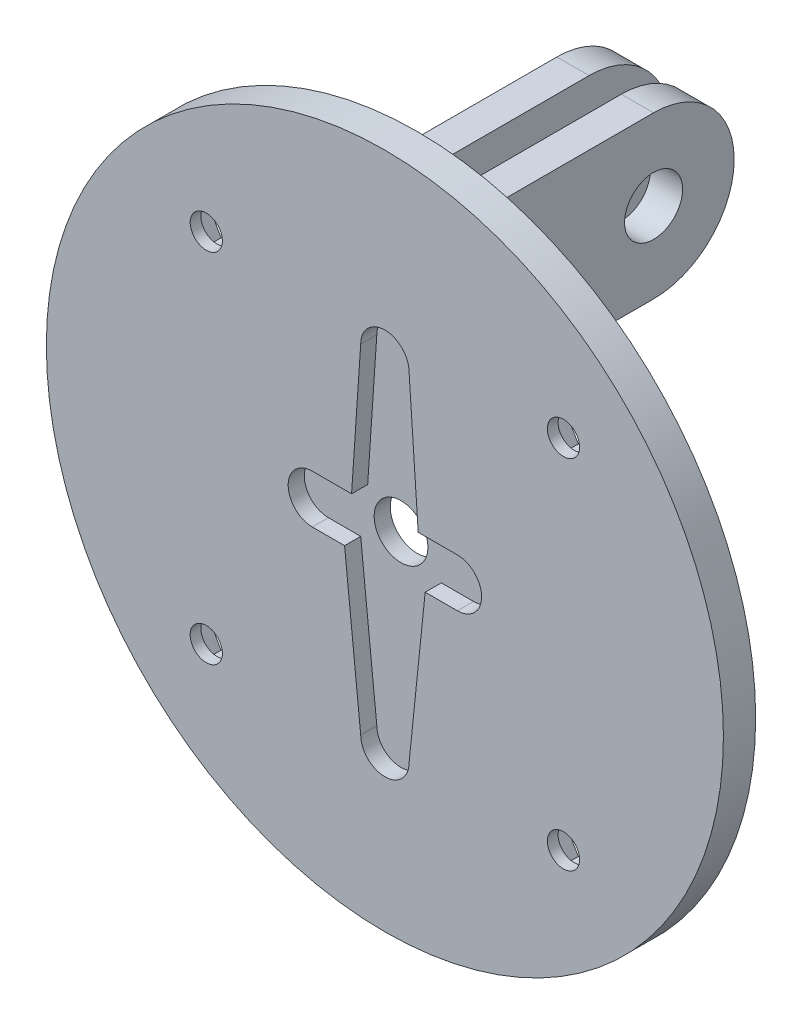
from build123d import *

# Parameters (mm, degrees)
CROQUIS1_R              = 31.5
CROQUIS1_R_2            = 1.5
SALIENTE_EXTRUIR1_DEPTH = 3
CORTAR_EXTRUIR2_DEPTH   = 1.5
CROQUIS4_R              = 2.5
CORTAR_EXTRUIR3_DEPTH   = 3
CROQUIS5_W              = 3
CROQUIS5_H              = 15
SALIENTE_EXTRUIR2_DEPTH = 25
CORTAR_EXTRUIR4_START   = -9
CROQUIS6_R              = 2.7
CORTAR_EXTRUIR4_DEPTH   = 9
CORTAR_EXTRUIR5_DEPTH   = 2


with BuildPart() as part:
    # Croquis1 → Saliente-Extruir1 (new body)
    with BuildSketch(Plane.XY):
        with Locations((-43.449193048, 8.207110309)):
            Circle(CROQUIS1_R)
        with Locations((-60.066202406, 24.824119667)):
            Circle(CROQUIS1_R_2, mode=Mode.SUBTRACT)
        with Locations((-26.83218369, 24.824119667)):
            Circle(CROQUIS1_R_2, mode=Mode.SUBTRACT)
        with Locations((-26.83218369, -8.409899049)):
            Circle(CROQUIS1_R_2, mode=Mode.SUBTRACT)
        with Locations((-60.066202406, -8.409899049)):
            Circle(CROQUIS1_R_2, mode=Mode.SUBTRACT)
    extrude(amount=SALIENTE_EXTRUIR1_DEPTH)

    # Croquis3 → Cortar-Extruir2 (cut)
    with BuildSketch(Plane.XY.offset(3)):
        with BuildLine():
            Line((-41.199193048, 22.957110309), (-40.349193048, 10.457110309))
            Line((-40.349193048, 10.457110309), (-36.699193048, 10.457110309))
            ThreePointArc((-36.699193048, 10.457110309), (-34.449193048, 8.207110309), (-36.699193048, 5.957110309))
            Line((-36.699193048, 5.957110309), (-39.699193048, 5.957110309))
            Line((-39.699193048, 5.957110309), (-41.199193048, -8.542889691))
            ThreePointArc((-41.199193048, -8.542889691), (-43.449193048, -10.792889691), (-45.699193048, -8.542889691))
            Line((-45.699193048, -8.542889691), (-47.199193048, 5.957110309))
            Line((-47.199193048, 5.957110309), (-50.199193048, 5.957110309))
            ThreePointArc((-50.199193048, 5.957110309), (-52.449193048, 8.207110309), (-50.199193048, 10.457110309))
            Line((-50.199193048, 10.457110309), (-46.549193048, 10.457110309))
            Line((-46.549193048, 10.457110309), (-45.699193048, 22.957110309))
            ThreePointArc((-45.699193048, 22.957110309), (-43.449193048, 25.207110309), (-41.199193048, 22.957110309))
        make_face()
    extrude(amount=-CORTAR_EXTRUIR2_DEPTH, mode=Mode.SUBTRACT)

    # Croquis4 → Cortar-Extruir3 (cut)
    with BuildSketch(Plane(origin=(0, 0, 0), x_dir=(-1, 0, 0), z_dir=(0, 0, -1))):
        with Locations((43.449193048, 8.207110309)):
            Circle(CROQUIS4_R)
    extrude(amount=-CORTAR_EXTRUIR3_DEPTH, mode=Mode.SUBTRACT)

    # Croquis5 → Saliente-Extruir2 (add)
    with BuildSketch(Plane(origin=(0, 0, 0), x_dir=(-1, 0, 0), z_dir=(0, 0, -1))):
        with Locations((40.449193048, 27.207110309)):
            Rectangle(CROQUIS5_W, CROQUIS5_H)
        with Locations((46.449193048, 27.207110309)):
            Rectangle(CROQUIS5_W, CROQUIS5_H)
    extrude(amount=SALIENTE_EXTRUIR2_DEPTH)

    # Croquis6 → Cortar-Extruir4 (cut)
    with BuildSketch(Plane(origin=(-38.949193048, 0, 0), x_dir=(0, 0, -1), z_dir=(1, 0, 0)).offset(CORTAR_EXTRUIR4_START)):
        with BuildLine():
            Line((25, 34.707110309), (17.5, 34.707110309))
            ThreePointArc((17.5, 34.707110309), (22.803300859, 32.510411168), (25, 27.207110309))
            Line((25, 27.207110309), (25, 34.707110309))
        make_face()
        with BuildLine():
            Line((25, 19.707110309), (25, 27.207110309))
            ThreePointArc((25, 27.207110309), (22.803300859, 21.90380945), (17.5, 19.707110309))
            Line((17.5, 19.707110309), (25, 19.707110309))
        make_face()
        with Locations(Location((17.5, 27.207110309, 0), (0, 0, 90))):
            Circle(CROQUIS6_R)
    extrude(amount=CORTAR_EXTRUIR4_DEPTH, mode=Mode.SUBTRACT)

    # Croquis7 → Cortar-Extruir5 (cut)
    with BuildSketch(Plane(origin=(0, 0, 0), x_dir=(-1, 0, 0), z_dir=(0, 0, -1))):
        Polygon((30.065345197, 24.824119667), (28.448764443, 27.624119667), (25.215602936, 27.624119667), (23.599022182, 24.824119667), (25.215602936, 22.024119667), (28.448764443, 22.024119667), align=None)
        Polygon((63.299363913, 24.824119667), (61.682783159, 27.624119667), (58.449621652, 27.624119667), (56.833040898, 24.824119667), (58.449621652, 22.024119667), (61.682783159, 22.024119667), align=None)
        Polygon((30.065345197, -8.409899049), (28.448764443, -5.609899049), (25.215602936, -5.609899049), (23.599022182, -8.409899049), (25.215602936, -11.209899049), (28.448764443, -11.209899049), align=None)
        Polygon((56.833040898, -8.409899049), (58.449621652, -11.209899049), (61.682783159, -11.209899049), (63.299363913, -8.409899049), (61.682783159, -5.609899049), (58.449621652, -5.609899049), align=None)
    extrude(amount=-CORTAR_EXTRUIR5_DEPTH, mode=Mode.SUBTRACT)


solid = part.part
